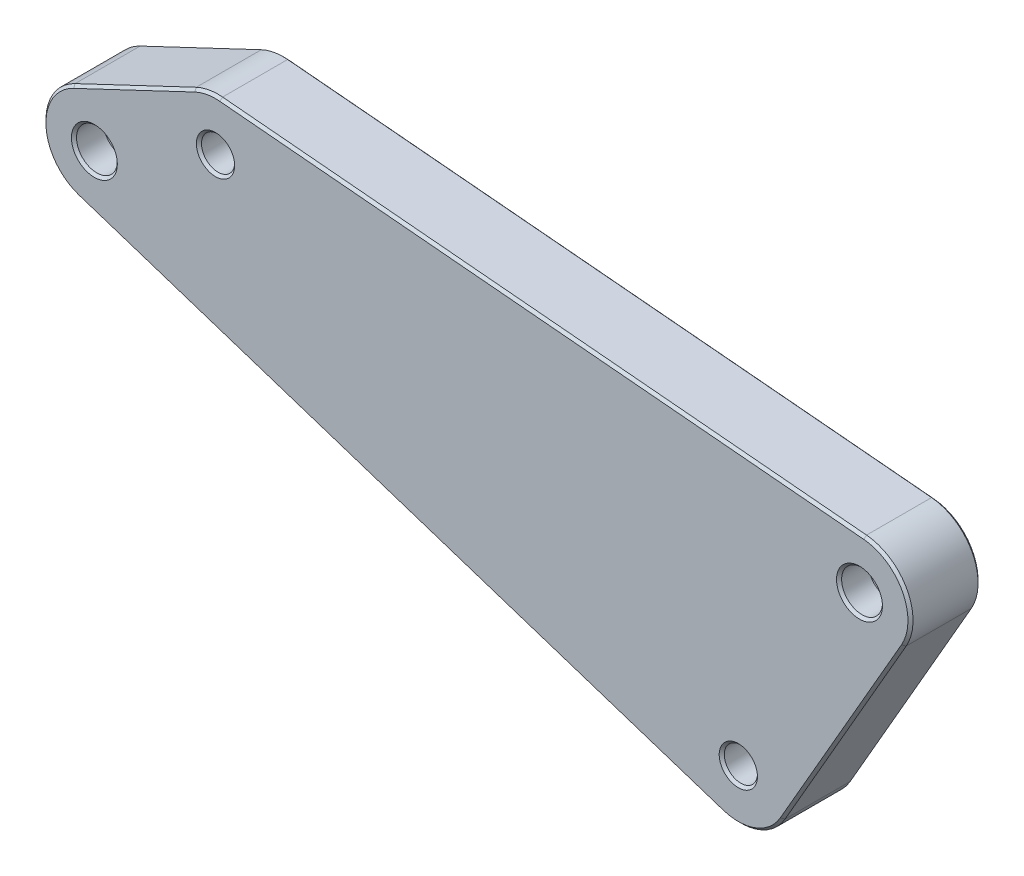
from build123d import *

# Parameters (mm, degrees)
SKETCH1_R           = 4
SKETCH1_R_2         = 1.6
SKETCH1_R_3         = 1.8
SKETCH1_R_4         = 1.3
BOSS_EXTRUDE1_DEPTH = 5.5
SKETCH2_R           = 2.8
CUT_EXTRUDE1_DEPTH  = 3.2
CHAMFER1_SIZE       = 0.2


with BuildPart() as part:
    # Sketch1 → Boss-Extrude1 (new body)
    # profile 1 of 7: a face of its own
    with BuildSketch(Plane.XY):
        with BuildLine():
            Line((30.355028895, 9.984213157), (-20.144971105, 14.484213157))
            ThreePointArc((-20.144971105, 14.484213157), (-17.548719297, 13.199989298), (-16.5, 10.5))
            ThreePointArc((-16.5, 10.5), (-22.638997252, 7.119956989), (-22.212345379, 14.114951356))
            Line((-22.212345379, 14.114951356), (-31.712345379, 9.614951356))
            ThreePointArc((-31.712345379, 9.614951356), (-27.861002748, 9.380043011), (-26, 6))
            ThreePointArc((-26, 6), (-27.651511703, 2.762006375), (-31.242301359, 2.197804932))
            Line((-31.242301359, 2.197804932), (19.257698641, -14.302195068))
            ThreePointArc((19.257698641, -14.302195068), (18.151511703, -7.262006375), (24.5, -10.5))
            ThreePointArc((24.5, -10.5), (24.364321371, -11.532966769), (23.966489827, -12.495857779))
            Line((23.966489827, -12.495857779), (33.466489827, 4.004142221))
            ThreePointArc((33.466489827, 4.004142221), (26.451575922, 4.153737137), (30.355028895, 9.984213157))
        make_face()
    # profile 2 of 7: a face of its own
    with BuildSketch(Plane.XY):
        with Locations((-30, 6)):
            Circle(SKETCH1_R)
        with Locations((-30, 6)):
            Circle(SKETCH1_R_2, mode=Mode.SUBTRACT)
    # profile 3 of 7: a face of its own
    with BuildSketch(Plane.XY):
        with Locations((-20.5, 10.5)):
            Circle(SKETCH1_R)
        with Locations((-20.5, 10.5)):
            Circle(SKETCH1_R_3, mode=Mode.SUBTRACT)
    # profile 4 of 7: a face of its own
    with BuildSketch(Plane.XY):
        with Locations((30, 6)):
            Circle(SKETCH1_R)
        with Locations((30, 6)):
            Circle(SKETCH1_R_2, mode=Mode.SUBTRACT)
    # profile 5 of 7: a face of its own
    with BuildSketch(Plane.XY):
        with Locations((20.5, -10.5)):
            Circle(SKETCH1_R)
        with Locations((20.5, -10.5)):
            Circle(SKETCH1_R_3, mode=Mode.SUBTRACT)
    # profile 6 of 7: a face of its own
    with BuildSketch(Plane.XY):
        with Locations((-20.5, 10.5)):
            Circle(SKETCH1_R_3)
        with Locations((-20.5, 10.5)):
            Circle(SKETCH1_R_4, mode=Mode.SUBTRACT)
    # profile 7 of 7: a face of its own
    with BuildSketch(Plane.XY):
        with Locations((20.5, -10.5)):
            Circle(SKETCH1_R_3)
        with Locations((20.5, -10.5)):
            Circle(SKETCH1_R_4, mode=Mode.SUBTRACT)
    extrude(amount=BOSS_EXTRUDE1_DEPTH)

    # Sketch2 → Cut-Extrude1 (cut)
    with BuildSketch(Plane.XY):
        with Locations((-30, 6)):
            Circle(SKETCH2_R)
        with Locations((30, 6)):
            Circle(SKETCH2_R)
    extrude(amount=CUT_EXTRUDE1_DEPTH, mode=Mode.SUBTRACT)

    # Chamfer1
    chamfer1_edges = [part.edges().sort_by_distance(p)[0] for p in [
        (33.548424078, 7.846262863, 5.5),
        (-21.8, 10.5, 0),
        (19.2, -10.5, 0),
        (21.932643426, -14.234639583, 0),
        (-5.992301359, -6.052195068, 0),
        (-33.991991934, 5.747017002, 0),
        (-26.962345379, 11.864951356, 0),
        (-21.203324661, 14.437681351, 0),
        (5.105028895, 12.234213157, 0),
        (5.105028895, 12.234213157, 5.5),
        (33.548424078, 7.846262863, 0),
        (28.716489827, -4.245857779, 0),
        (-21.203324661, 14.437681351, 5.5),
        (-26.962345379, 11.864951356, 5.5),
        (-33.991991934, 5.747017002, 5.5),
        (-5.992301359, -6.052195068, 5.5),
        (21.932643426, -14.234639583, 5.5),
        (-31.6, 6, 5.5),
        (28.4, 6, 5.5),
        (-32.8, 6, 0),
        (19.2, -10.5, 5.5),
        (27.2, 6, 0),
        (-21.8, 10.5, 5.5),
        (28.716489827, -4.245857779, 5.5),
    ]]
    chamfer(chamfer1_edges, length=CHAMFER1_SIZE)


solid = part.part
